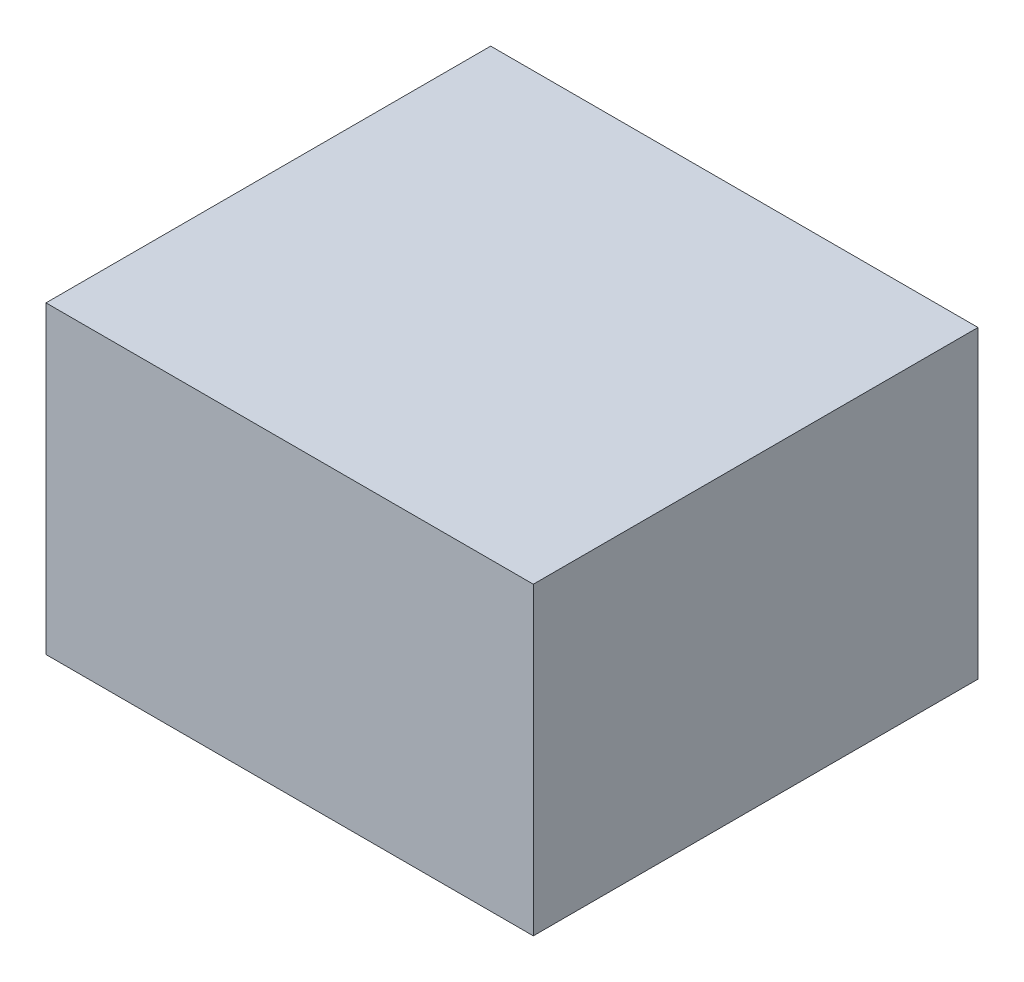
from build123d import *

# Parameters (mm, degrees)
SKETCH1_W           = 16
SKETCH1_H           = 14.6
BOSS_EXTRUDE1_DEPTH = 10


with BuildPart() as part:
    # Sketch1 → Boss-Extrude1 (new body)
    with BuildSketch(Plane(origin=(0, 0, 0), x_dir=(1, 0, 0), z_dir=(0, 1, 0))):
        with Locations((1.181818182, -1.845454545)):
            Rectangle(SKETCH1_W, SKETCH1_H)
    extrude(amount=BOSS_EXTRUDE1_DEPTH)


solid = part.part
